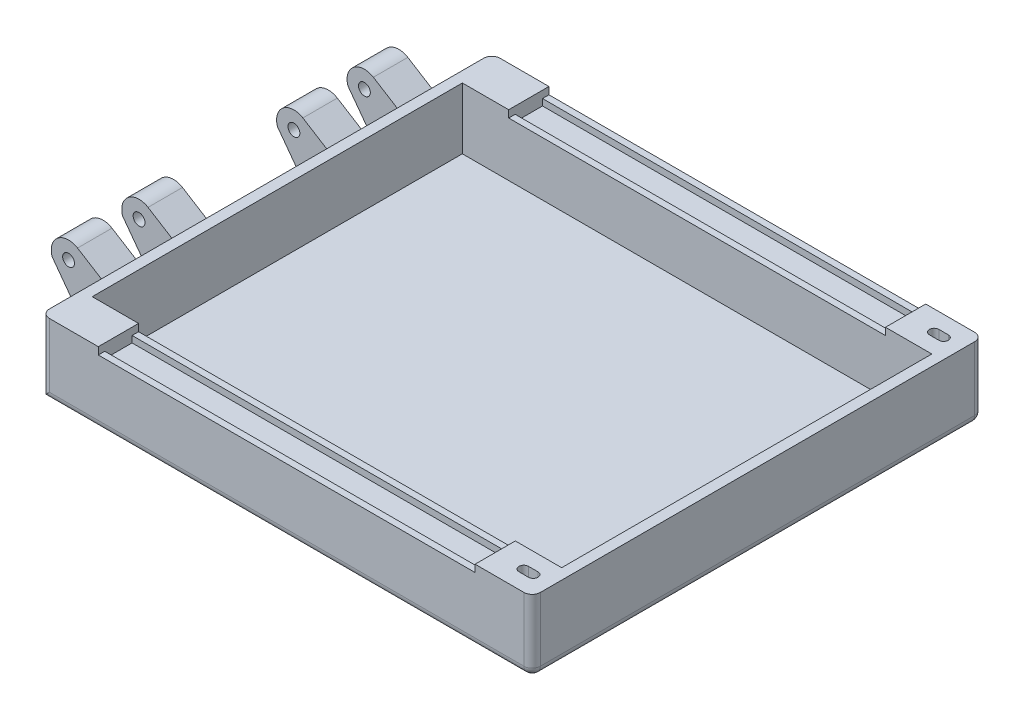
from build123d import *

# Parameters (mm, degrees)
SKETCH1_W               = 228.04
SKETCH1_H               = 209.32
BOSS_EXTRUDE1_DEPTH     = 33.5
SKETCH2_W               = 218.04
SKETCH2_H               = 171.92
CUT_EXTRUDE1_DEPTH      = 28.5
SKETCH4_W               = 175
SKETCH4_H               = 18.7
CUT_EXTRUDE2_DEPTH      = 3.35
SKETCH5_W               = 175
SKETCH5_H               = 12.7
CUT_EXTRUDE3_DEPTH      = 3
SKETCH6_W               = 175
SKETCH6_H               = 18.7
CUT_EXTRUDE4_DEPTH      = 3.35
SKETCH7_W               = 175
SKETCH7_H               = 12.7
CUT_EXTRUDE5_DEPTH      = 3
SKETCH9_R               = 2.75
BOSS_EXTRUDE2_DEPTH     = 8
MIRROR2_COPY_1_SKETCH_R = 2.75
MIRROR2_COPY_1_DEPTH    = 8
CUT_EXTRUDE6_DEPTH      = 33.5
FILLET3_R               = 3.81


with BuildPart() as part:
    # Sketch1 → Boss-Extrude1 (new body)
    with BuildSketch(Plane(origin=(0, 0, 0), x_dir=(1, 0, 0), z_dir=(0, 1, 0))):
        Rectangle(SKETCH1_W, SKETCH1_H)
    extrude(amount=BOSS_EXTRUDE1_DEPTH)

    # Sketch2 → Cut-Extrude1 (cut)
    with BuildSketch(Plane(origin=(0, 33.5, 0), x_dir=(1, 0, 0), z_dir=(0, 1, 0))):
        Rectangle(SKETCH2_W, SKETCH2_H)
    extrude(amount=-CUT_EXTRUDE1_DEPTH, mode=Mode.SUBTRACT)

    # Sketch4 → Cut-Extrude2 (cut)
    with BuildSketch(Plane(origin=(0, 33.5, 0), x_dir=(1, 0, 0), z_dir=(0, 1, 0))):
        with Locations((0, -95.31)):
            Rectangle(SKETCH4_W, SKETCH4_H)
    extrude(amount=-CUT_EXTRUDE2_DEPTH, mode=Mode.SUBTRACT)

    # Sketch5 → Cut-Extrude3 (cut)
    with BuildSketch(Plane(origin=(0, 30.15, 0), x_dir=(1, 0, 0), z_dir=(0, 1, 0))):
        with Locations((0, -95.31)):
            Rectangle(SKETCH5_W, SKETCH5_H)
    extrude(amount=-CUT_EXTRUDE3_DEPTH, mode=Mode.SUBTRACT)

    # Sketch6 → Cut-Extrude4 (cut)
    with BuildSketch(Plane(origin=(0, 33.5, 0), x_dir=(1, 0, 0), z_dir=(0, 1, 0))):
        with Locations((0, 95.31)):
            Rectangle(SKETCH6_W, SKETCH6_H)
    extrude(amount=-CUT_EXTRUDE4_DEPTH, mode=Mode.SUBTRACT)

    # Sketch7 → Cut-Extrude5 (cut)
    with BuildSketch(Plane(origin=(0, 30.15, 0), x_dir=(1, 0, 0), z_dir=(0, 1, 0))):
        with Locations((0, 95.31)):
            Rectangle(SKETCH7_W, SKETCH7_H)
    extrude(amount=-CUT_EXTRUDE5_DEPTH, mode=Mode.SUBTRACT)

    # Sketch9 → Boss-Extrude2 (add, symmetric)
    with BuildSketch(Plane.XY.offset(-35.96)):
        with BuildLine():
            Line((-114.02, 0), (-136.905438379, 30.980124606))
            ThreePointArc((-136.905438379, 30.980124606), (-134.276086797, 39.796139551), (-125.095451514, 40.389051887))
            Line((-125.095451514, 40.389051887), (-114.02, 33.5))
            Line((-114.02, 33.5), (-114.02, 0))
        make_face()
        with Locations((-129.26, 33.5)):
            Circle(SKETCH9_R, mode=Mode.SUBTRACT)
    boss_extrude2 = extrude(amount=BOSS_EXTRUDE2_DEPTH, both=True)

    # Mirror1: Boss-Extrude2 across plane
    add(boss_extrude2.mirror(Plane.XY.offset(-52.33)))

    # Mirror2: Boss-Extrude2 across plane
    add(boss_extrude2.mirror(Plane.XY))

    # Mirror2 copy 1 sketch → Mirror2 copy 1 (add, symmetric)
    with BuildSketch(Plane.XY.offset(68.7)):
        with BuildLine():
            Line((-114.02, 0), (-136.905438379, 30.980124606))
            ThreePointArc((-136.905438379, 30.980124606), (-134.276086797, 39.796139551), (-125.095451514, 40.389051887))
            Line((-125.095451514, 40.389051887), (-114.02, 33.5))
            Line((-114.02, 33.5), (-114.02, 0))
        make_face()
        with Locations((-129.26, 33.5)):
            Circle(MIRROR2_COPY_1_SKETCH_R, mode=Mode.SUBTRACT)
    extrude(amount=MIRROR2_COPY_1_DEPTH, both=True)

    # Sketch11 → Cut-Extrude6 (cut)
    with BuildSketch(Plane(origin=(0, 33.5, 0), x_dir=(1, 0, 0), z_dir=(0, 1, 0))):
        with BuildLine():
            Line((100.76, 93.11), (105.160002263, 93.11))
            ThreePointArc((105.160002263, 93.11), (107.360001132, 95.310001132), (105.16, 97.51))
            Line((105.16, 97.51), (100.76, 97.51))
            ThreePointArc((100.76, 97.51), (98.56, 95.31), (100.76, 93.11))
        make_face()
    cut_extrude6 = extrude(amount=-CUT_EXTRUDE6_DEPTH, mode=Mode.SUBTRACT)

    # Mirror3: Cut-Extrude6 across plane
    add(cut_extrude6.mirror(Plane.XY), mode=Mode.SUBTRACT)

    # Fillet3
    fillet3_edges = [part.edges().sort_by_distance(p)[0] for p in [
        (0, 0, 104.66),
        (0, 0, -104.66),
        (114.02, 0, 0),
        (114.02, 16.75, 104.66),
        (-114.02, 16.75, 104.66),
        (-114.02, 16.75, -104.66),
        (114.02, 16.75, -104.66),
    ]]
    fillet(fillet3_edges, radius=FILLET3_R)


solid = part.part
